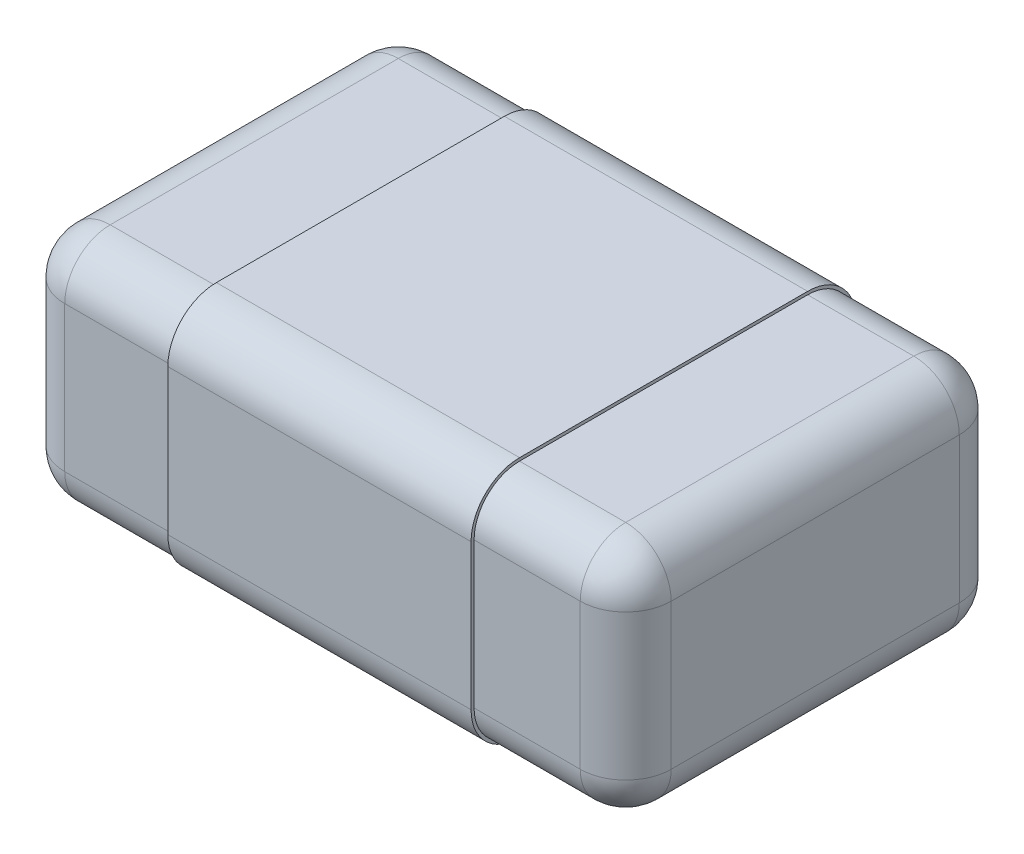
from build123d import *

# Parameters (mm, degrees)
ESBO_O1_W                     = 2
ESBO_O1_H                     = 1.25
RESSALTO_EXTRUS_O1_DEPTH      = 0.78
FILETE1_R                     = 0.15
RESSALTO_EXTRUS_O4_DEPTH      = 0.5
RESSALTO_EXTRUS_O4_DEPTH_BACK = 0.5
RESSALTO_EXTRUS_O5_DEPTH      = 0.02


with BuildPart() as part:
    # Esboço1 → Ressalto-extrusão1 (new body)
    with BuildSketch(Plane(origin=(0, 0, 0), x_dir=(1, 0, 0), z_dir=(0, 1, 0))):
        Rectangle(ESBO_O1_W, ESBO_O1_H)
    extrude(amount=-RESSALTO_EXTRUS_O1_DEPTH)

    # Filete1
    filete1_edges = [part.edges().sort_by_distance(p)[0] for p in [
        (1, -0.78, 0),
        (0, -0.78, -0.625),
        (-1, -0.78, 0),
        (0, 0, -0.625),
        (1, 0, 0),
        (0, 0, 0.625),
        (-1, 0, 0),
        (0, -0.78, 0.625),
        (-1, -0.39, -0.625),
        (1, -0.39, -0.625),
        (1, -0.39, 0.625),
        (-1, -0.39, 0.625),
    ]]
    fillet(filete1_edges, radius=FILETE1_R)

    # Esboço4 → Ressalto-extrusão4 (add, two sides: drawn at the far end of the back side and taken through both)
    with BuildSketch(Plane(origin=(0, 0, 0), x_dir=(0, 0, -1), z_dir=(1, 0, 0)).offset(-RESSALTO_EXTRUS_O4_DEPTH_BACK)):
        with BuildLine():
            Line((0.635, -0.63), (0.635, -0.15))
            ThreePointArc((0.635, -0.15), (0.588137085, -0.036862915), (0.475, 0.01))
            Line((0.475, 0.01), (-0.475, 0.01))
            ThreePointArc((-0.475, 0.01), (-0.588137085, -0.036862915), (-0.635, -0.15))
            Line((-0.635, -0.15), (-0.635, -0.63))
            ThreePointArc((-0.635, -0.63), (-0.588137085, -0.743137085), (-0.475, -0.79))
            Line((-0.475, -0.79), (0.475, -0.79))
            ThreePointArc((0.475, -0.79), (0.588137085, -0.743137085), (0.635, -0.63))
        make_face()
        with BuildLine():
            Line((0.625, -0.63), (0.625, -0.15))
            ThreePointArc((0.625, -0.15), (0.581066017, -0.043933983), (0.475, 0))
            Line((0.475, 0), (-0.475, 0))
            ThreePointArc((-0.475, 0), (-0.581066017, -0.043933983), (-0.625, -0.15))
            Line((-0.625, -0.15), (-0.625, -0.63))
            ThreePointArc((-0.625, -0.63), (-0.581066017, -0.736066017), (-0.475, -0.78))
            Line((-0.475, -0.78), (0.475, -0.78))
            ThreePointArc((0.475, -0.78), (0.581066017, -0.736066017), (0.625, -0.63))
        make_face(mode=Mode.SUBTRACT)
    extrude(amount=RESSALTO_EXTRUS_O4_DEPTH + RESSALTO_EXTRUS_O4_DEPTH_BACK)

    # Esboço2 → Ressalto-extrusão5 (add)
    with BuildSketch(Plane(origin=(0, -0.79, 0), x_dir=(0, 0, 1), z_dir=(0, -1, 0))):
        with BuildLine():
            Line((0.240411447, -0.227848101), (0.240411447, -0.449367089))
            Line((0.240411447, -0.449367089), (0.151803852, -0.449367089))
            Line((0.151803852, -0.449367089), (0.151803852, -0.379746835))
            Line((0.151803852, -0.379746835), (-0.107689819, -0.379746835))
            Line((-0.107689819, -0.379746835), (-0.107689819, -0.449367089))
            Line((-0.107689819, -0.449367089), (-0.1899683, -0.449367089))
            add(Edge.make_bspline(
                [(-0.1899683, -0.449367089), (-0.19012994, -0.444249723), (-0.190452713, -0.434031056), (-0.192371039, -0.421451182), (-0.194625359, -0.411846862), (-0.196936571, -0.40541324), (-0.199537979, -0.399615701), (-0.201880811, -0.396296502), (-0.203022097, -0.394679589)],
                knots=[0, 0, 0, 0, 1.613816483, 3.222566973, 4.00434643, 4.721272461, 5.377081126, 6, 6, 6, 6], degree=3))
            add(Edge.make_bspline(
                [(-0.203022097, -0.394679589), (-0.204461211, -0.392957177), (-0.20735537, -0.389493284), (-0.212568341, -0.384991041), (-0.218600713, -0.381270226), (-0.225242397, -0.377986704), (-0.232653657, -0.375269127), (-0.24089787, -0.373371747), (-0.249954795, -0.371959143), (-0.256286804, -0.371552842), (-0.259588553, -0.371340981)],
                knots=[0, 0, 0, 0, 0.85147813, 1.712383349, 2.601498934, 3.536495334, 4.522642149, 5.591462363, 6.74409729, 8, 8, 8, 8], degree=3))
            Line((-0.259588553, -0.371340981), (-0.259588553, -0.297468354))
            Line((-0.259588553, -0.297468354), (0.151803852, -0.297468354))
            Line((0.151803852, -0.297468354), (0.151803852, -0.227848101))
            Line((0.151803852, -0.227848101), (0.240411447, -0.227848101))
        make_face()
        with BuildLine():
            Line((0.240411447, 0.120886076), (0.240411447, -0.125949367))
            Line((0.240411447, -0.125949367), (0.158330751, -0.125949367))
            add(Edge.make_bspline(
                [(0.158330751, -0.125949367), (0.152214367, -0.120887492), (0.140208237, -0.110951304), (0.12230397, -0.0966561), (0.104986645, -0.083034363), (0.088088852, -0.070297559), (0.071638652, -0.058342649), (0.055729879, -0.0469833), (0.04010761, -0.036552305), (0.02977976, -0.029910657), (0.024727112, -0.026661392)],
                knots=[0, 0, 0, 0, 1.143871494, 2.245357909, 3.300914739, 4.318253735, 5.293884102, 6.230829319, 7.13447631, 8, 8, 8, 8], degree=3))
            add(Edge.make_bspline(
                [(0.024727112, -0.026661392), (0.018467772, -0.022807477), (0.00649251, -0.01543423), (-0.011299949, -0.005831909), (-0.027841839, 0.002212488), (-0.043428254, 0.008711535), (-0.058501424, 0.013740093), (-0.073657737, 0.017037996), (-0.088968207, 0.019226969), (-0.099276497, 0.019489231), (-0.104426369, 0.019620253)],
                knots=[0, 0, 0, 0, 1.267768508, 2.425473269, 3.486024264, 4.439590646, 5.336903618, 6.222592004, 7.112032784, 8, 8, 8, 8], degree=3))
            add(Edge.make_bspline(
                [(-0.104426369, 0.019620253), (-0.109973533, 0.019457389), (-0.120442742, 0.019150014), (-0.135183808, 0.016680702), (-0.147862366, 0.012207249), (-0.158544157, 0.006120486), (-0.16699737, -0.001718213), (-0.172986786, -0.011118674), (-0.176714501, -0.021909536), (-0.177106684, -0.029597078), (-0.177310072, -0.033583861)],
                knots=[0, 0, 0, 0, 1.306909451, 2.466541577, 3.505869428, 4.459795217, 5.344572835, 6.193571478, 7.063180651, 8, 8, 8, 8], degree=3))
            add(Edge.make_bspline(
                [(-0.177310072, -0.033583861), (-0.177088445, -0.037797417), (-0.176649647, -0.046139784), (-0.172906717, -0.058228164), (-0.167362161, -0.069794193), (-0.162961227, -0.077292083), (-0.160696148, -0.081151108)],
                knots=[0, 0, 0, 0, 0.988472559, 1.957064427, 2.948539211, 4, 4, 4, 4], degree=3))
            add(Edge.make_bspline(
                [(-0.160696148, -0.081151108), (-0.158162705, -0.084765881), (-0.153335217, -0.091653849), (-0.14551733, -0.100442138), (-0.138585493, -0.107235065), (-0.134646389, -0.111371202), (-0.133006275, -0.113093354)],
                knots=[0, 0, 0, 0, 1.249878488, 2.381649198, 3.326171657, 4, 4, 4, 4], degree=3))
            Line((-0.133006275, -0.113093354), (-0.133006275, -0.119620253))
            Line((-0.133006275, -0.119620253), (-0.241293458, -0.119620253))
            add(Edge.make_bspline(
                [(-0.241293458, -0.119620253), (-0.243030602, -0.116915918), (-0.246833272, -0.110996035), (-0.251734635, -0.100573059), (-0.256834934, -0.088217246), (-0.26197876, -0.074279085), (-0.266458759, -0.059444232), (-0.269739252, -0.04443776), (-0.271805277, -0.029718517), (-0.272101339, -0.019975966), (-0.272246781, -0.015189873)],
                knots=[0, 0, 0, 0, 0.69970136, 1.531670699, 2.504079761, 3.612943238, 4.767349377, 5.877514774, 6.957315063, 8, 8, 8, 8], degree=3))
            add(Edge.make_bspline(
                [(-0.272246781, -0.015189873), (-0.272145838, -0.010272103), (-0.271949257, -0.000695027), (-0.270052265, 0.013195591), (-0.266883874, 0.026152524), (-0.262513205, 0.038190645), (-0.2570145, 0.049402474), (-0.24997581, 0.059529553), (-0.241814993, 0.068790356), (-0.232475839, 0.077159072), (-0.221906303, 0.084420345), (-0.21043315, 0.090921092), (-0.197820463, 0.096215142), (-0.184283525, 0.100709579), (-0.169658558, 0.103983447), (-0.154107163, 0.106468649), (-0.137518514, 0.107964222), (-0.126119876, 0.108138228), (-0.120249154, 0.108227848)],
                knots=[0, 0, 0, 0, 1.059873424, 2.064042983, 3.015596836, 3.930697506, 4.820695307, 5.699957467, 6.581199529, 7.477193696, 8.396013015, 9.341094634, 10.315416404, 11.340324501, 12.412707035, 13.542640562, 14.734368785, 16, 16, 16, 16], degree=3))
            add(Edge.make_bspline(
                [(-0.120249154, 0.108227848), (-0.112856677, 0.108059762), (-0.098089689, 0.107723999), (-0.076109458, 0.104913559), (-0.054324675, 0.100623497), (-0.032644635, 0.094266035), (-0.010659972, 0.085942561), (0.01194365, 0.075421379), (0.035218138, 0.062351564), (0.050657644, 0.052374248), (0.058647207, 0.047211234)],
                knots=[0, 0, 0, 0, 0.92383478, 1.845424201, 2.765944236, 3.697111989, 4.666093288, 5.70224482, 6.810968485, 8, 8, 8, 8], degree=3))
            add(Edge.make_bspline(
                [(0.058647207, 0.047211234), (0.063540545, 0.043836713), (0.073096713, 0.037246632), (0.086879374, 0.027223149), (0.099855338, 0.017352653), (0.111778424, 0.007693196), (0.122497499, -0.001175041), (0.13166194, -0.008894608), (0.139184524, -0.015177183), (0.143567164, -0.018975648), (0.145474738, -0.020628956)],
                knots=[0, 0, 0, 0, 1.293836837, 2.526725554, 3.709287413, 4.842241028, 5.866627263, 6.737584004, 7.450524958, 8, 8, 8, 8], degree=3))
            Line((0.145474738, -0.020628956), (0.145474738, 0.120886076))
            Line((0.145474738, 0.120886076), (0.240411447, 0.120886076))
        make_face()
        with BuildLine():
            Line((0.240411447, 0.456962025), (0.240411447, 0.210126582))
            Line((0.240411447, 0.210126582), (0.158330751, 0.210126582))
            add(Edge.make_bspline(
                [(0.158330751, 0.210126582), (0.152214367, 0.215188458), (0.140208237, 0.225124645), (0.12230397, 0.239419849), (0.104986645, 0.253041586), (0.088088852, 0.26577839), (0.071638652, 0.277733301), (0.055729879, 0.289092649), (0.04010761, 0.299523645), (0.02977976, 0.306165292), (0.024727112, 0.309414557)],
                knots=[0, 0, 0, 0, 1.143871494, 2.245357909, 3.300914739, 4.318253735, 5.293884102, 6.230829319, 7.13447631, 8, 8, 8, 8], degree=3))
            add(Edge.make_bspline(
                [(0.024727112, 0.309414557), (0.018467772, 0.313268473), (0.00649251, 0.32064172), (-0.011299949, 0.33024404), (-0.027841839, 0.338288438), (-0.043428254, 0.344787485), (-0.058501424, 0.349816043), (-0.073657737, 0.353113945), (-0.088968207, 0.355302918), (-0.099276497, 0.35556518), (-0.104426369, 0.355696203)],
                knots=[0, 0, 0, 0, 1.267768508, 2.425473269, 3.486024264, 4.439590646, 5.336903618, 6.222592004, 7.112032784, 8, 8, 8, 8], degree=3))
            add(Edge.make_bspline(
                [(-0.104426369, 0.355696203), (-0.109973533, 0.355533338), (-0.120442742, 0.355225964), (-0.135183808, 0.352756651), (-0.147862366, 0.348283198), (-0.158544157, 0.342196435), (-0.16699737, 0.334357737), (-0.172986786, 0.324957276), (-0.176714501, 0.314166414), (-0.177106684, 0.306478871), (-0.177310072, 0.302492089)],
                knots=[0, 0, 0, 0, 1.306909451, 2.466541577, 3.505869428, 4.459795217, 5.344572835, 6.193571478, 7.063180651, 8, 8, 8, 8], degree=3))
            add(Edge.make_bspline(
                [(-0.177310072, 0.302492089), (-0.177088445, 0.298278533), (-0.176649647, 0.289936166), (-0.172906717, 0.277847785), (-0.167362161, 0.266281756), (-0.162961227, 0.258783866), (-0.160696148, 0.254924842)],
                knots=[0, 0, 0, 0, 0.988472559, 1.957064427, 2.948539211, 4, 4, 4, 4], degree=3))
            add(Edge.make_bspline(
                [(-0.160696148, 0.254924842), (-0.158162705, 0.251310068), (-0.153335217, 0.244422101), (-0.14551733, 0.235633811), (-0.138585493, 0.228840884), (-0.134646389, 0.224704747), (-0.133006275, 0.222982595)],
                knots=[0, 0, 0, 0, 1.249878488, 2.381649198, 3.326171657, 4, 4, 4, 4], degree=3))
            Line((-0.133006275, 0.222982595), (-0.133006275, 0.216455696))
            Line((-0.133006275, 0.216455696), (-0.241293458, 0.216455696))
            add(Edge.make_bspline(
                [(-0.241293458, 0.216455696), (-0.243030602, 0.219160031), (-0.246833272, 0.225079915), (-0.251734635, 0.23550289), (-0.256834934, 0.247858703), (-0.26197876, 0.261796864), (-0.266458759, 0.276631717), (-0.269739252, 0.29163819), (-0.271805277, 0.306357432), (-0.272101339, 0.316099983), (-0.272246781, 0.320886076)],
                knots=[0, 0, 0, 0, 0.69970136, 1.531670699, 2.504079761, 3.612943238, 4.767349377, 5.877514774, 6.957315063, 8, 8, 8, 8], degree=3))
            add(Edge.make_bspline(
                [(-0.272246781, 0.320886076), (-0.272145838, 0.325803846), (-0.271949257, 0.335380922), (-0.270052265, 0.349271541), (-0.266883874, 0.362228473), (-0.262513205, 0.374266594), (-0.2570145, 0.385478423), (-0.24997581, 0.395605503), (-0.241814993, 0.404866306), (-0.232475839, 0.413235021), (-0.221906303, 0.420496294), (-0.21043315, 0.426997042), (-0.197820463, 0.432291091), (-0.184283525, 0.436785528), (-0.169658558, 0.440059396), (-0.154107163, 0.442544598), (-0.137518514, 0.444040172), (-0.126119876, 0.444214178), (-0.120249154, 0.444303797)],
                knots=[0, 0, 0, 0, 1.059873424, 2.064042983, 3.015596836, 3.930697506, 4.820695307, 5.699957467, 6.581199529, 7.477193696, 8.396013015, 9.341094634, 10.315416404, 11.340324501, 12.412707035, 13.542640562, 14.734368785, 16, 16, 16, 16], degree=3))
            add(Edge.make_bspline(
                [(-0.120249154, 0.444303797), (-0.112856677, 0.444135712), (-0.098089689, 0.443799948), (-0.076109458, 0.440989509), (-0.054324675, 0.436699446), (-0.032644635, 0.430341984), (-0.010659972, 0.42201851), (0.01194365, 0.411497328), (0.035218138, 0.398427513), (0.050657644, 0.388450198), (0.058647207, 0.383287184)],
                knots=[0, 0, 0, 0, 0.92383478, 1.845424201, 2.765944236, 3.697111989, 4.666093288, 5.70224482, 6.810968485, 8, 8, 8, 8], degree=3))
            add(Edge.make_bspline(
                [(0.058647207, 0.383287184), (0.063540545, 0.379912662), (0.073096713, 0.373322582), (0.086879374, 0.363299098), (0.099855338, 0.353428602), (0.111778424, 0.343769145), (0.122497499, 0.334900909), (0.13166194, 0.327181341), (0.139184524, 0.320898767), (0.143567164, 0.317100301), (0.145474738, 0.315446994)],
                knots=[0, 0, 0, 0, 1.293836837, 2.526725554, 3.709287413, 4.842241028, 5.866627263, 6.737584004, 7.450524958, 8, 8, 8, 8], degree=3))
            Line((0.145474738, 0.315446994), (0.145474738, 0.456962025))
            Line((0.145474738, 0.456962025), (0.240411447, 0.456962025))
        make_face()
    extrude(amount=RESSALTO_EXTRUS_O5_DEPTH)


solid = part.part
